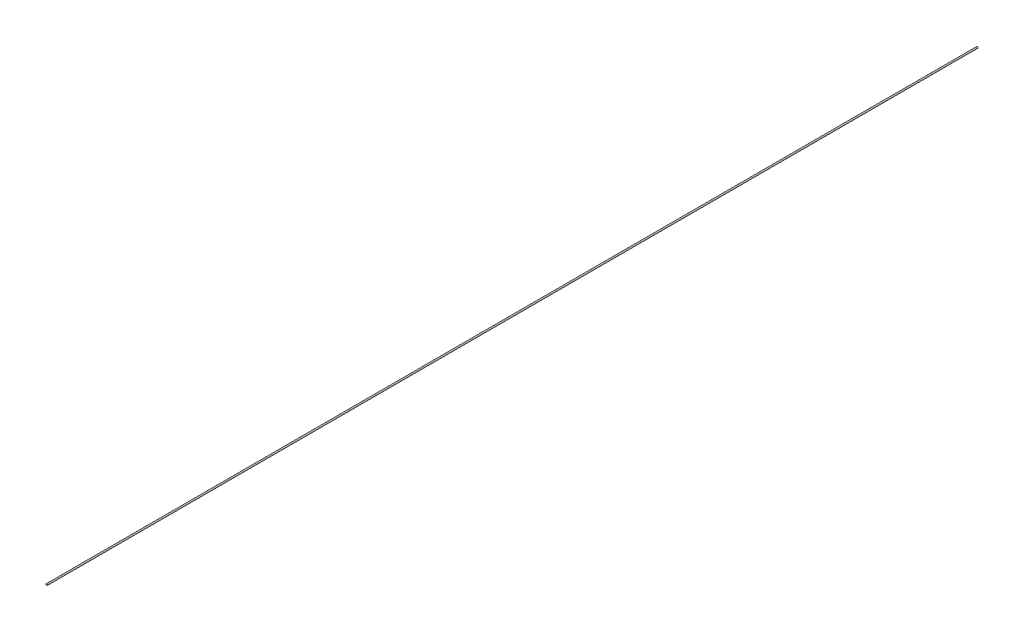
from build123d import *

# Parameters (mm, degrees)
SKETCH1_R           = 0.1
BOSS_EXTRUDE1_DEPTH = 125


with BuildPart() as part:
    # Sketch1 → Boss-Extrude1 (new body)
    with BuildSketch(Plane.XY):
        Circle(SKETCH1_R)
    extrude(amount=BOSS_EXTRUDE1_DEPTH)


solid = part.part
